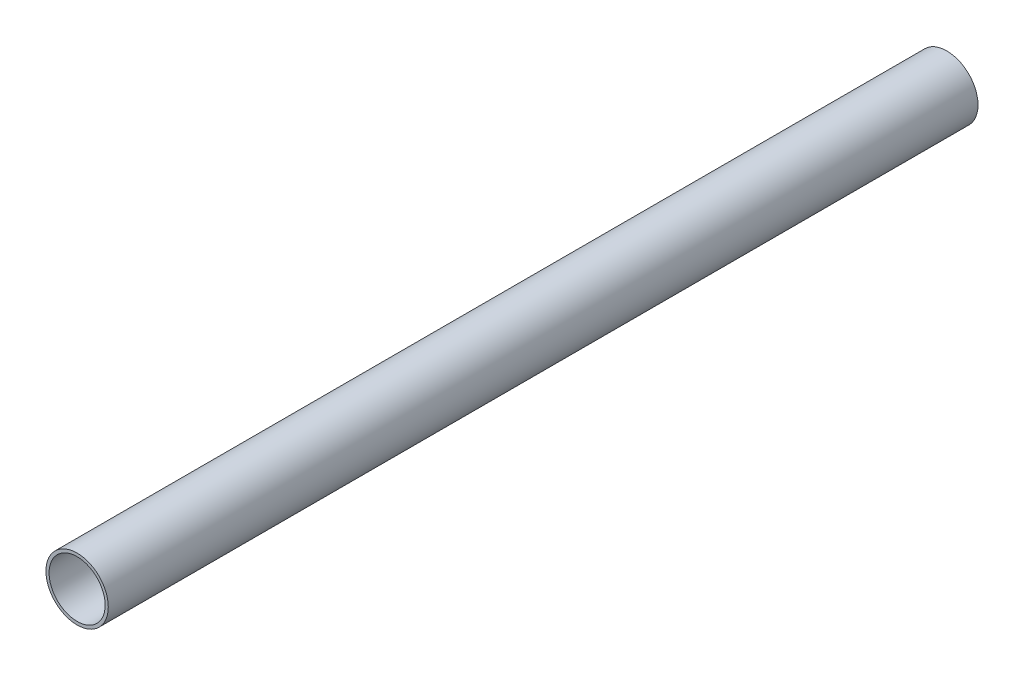
from build123d import *

# Parameters (mm, degrees)
SKETCH_1_R      = 10
SKETCH_1_R_2    = 9
EXTRUDE_1_DEPTH = 279


with BuildPart() as part:
    # 草图1 → 凸台-拉伸1 (new body)
    with BuildSketch(Plane.XY):
        Circle(SKETCH_1_R)
        Circle(SKETCH_1_R_2, mode=Mode.SUBTRACT)
    extrude(amount=EXTRUDE_1_DEPTH)


solid = part.part
